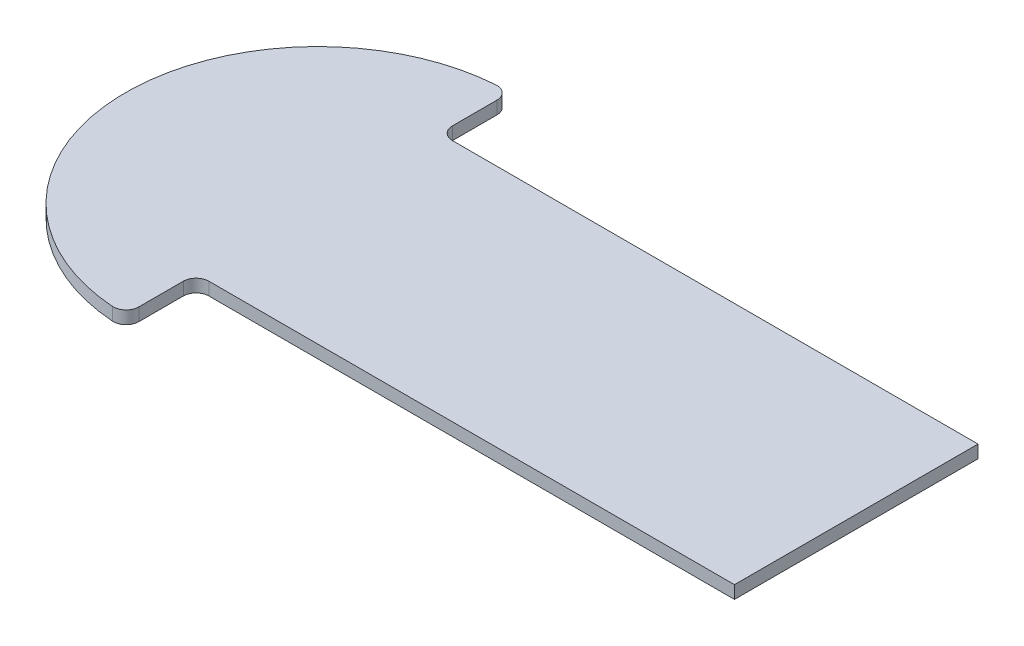
from build123d import *

# Parameters (mm, degrees)
SKETCH1_W           = 42
SKETCH1_H           = 19
BOSS_EXTRUDE1_DEPTH = 1
FILLET1_R           = 1


with BuildPart() as part:
    # Sketch1 → Boss-Extrude1 (new body)
    with BuildSketch(Plane(origin=(0, 0, 0), x_dir=(1, 0, 0), z_dir=(0, 1, 0))):
        with BuildLine():
            Line((-21, 15), (-21, 9.5))
            Line((-21, 9.5), (-21, -9.5))
            Line((-21, -9.5), (-21, -15))
            ThreePointArc((-21, -15), (-36, 0), (-21, 15))
        make_face()
        Rectangle(SKETCH1_W, SKETCH1_H)
    extrude(amount=BOSS_EXTRUDE1_DEPTH)

    # Fillet1
    fillet1_edges = [part.edges().sort_by_distance(p)[0] for p in [
        (-21, 0.5, -9.5),
        (-21, 0.5, 9.5),
        (-21, 0.5, 15),
        (-21, 0.5, -15),
    ]]
    fillet(fillet1_edges, radius=FILLET1_R)


solid = part.part
